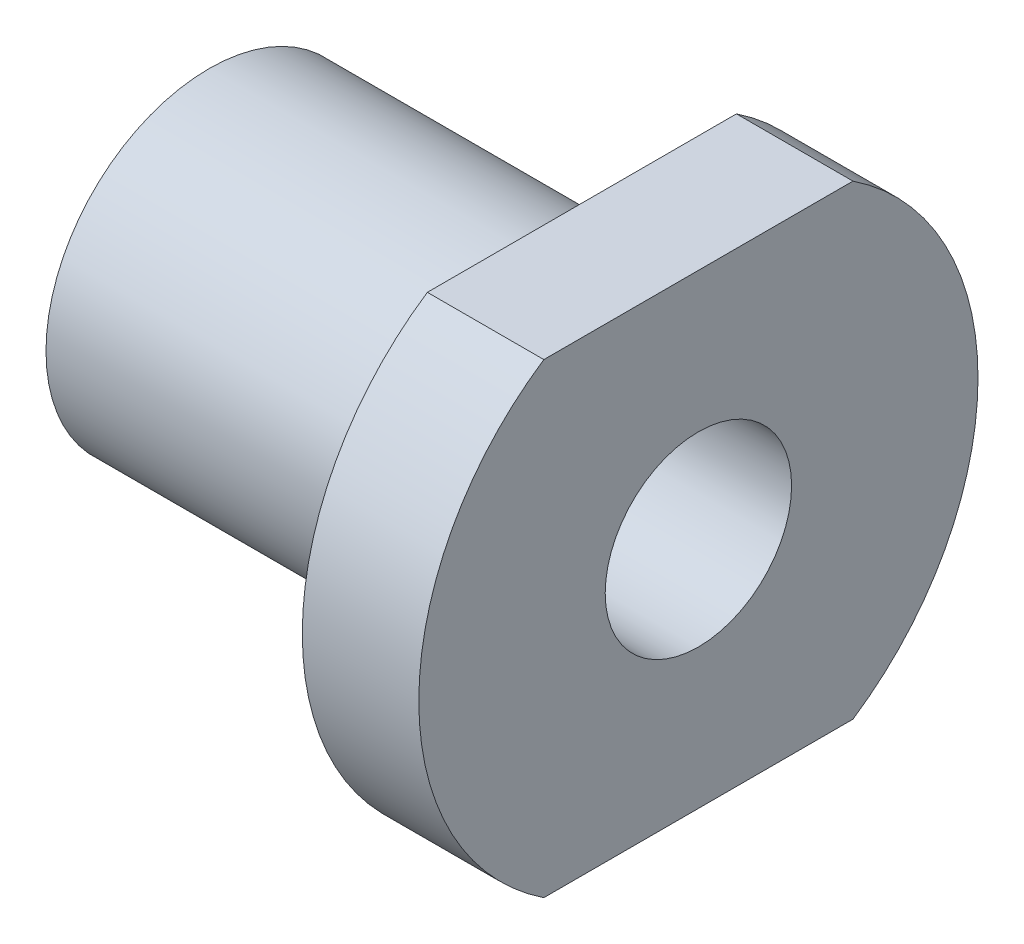
from build123d import *

# Parameters (mm, degrees)
CROQUIS2_OUTSIDE_W    = 65.964
CROQUIS2_OUTSIDE_H    = 65.964
CROQUIS2_OUTSIDE_W_2  = 60
CROQUIS2_OUTSIDE_H_2  = 40
CORTAR_EXTRUIR1_DEPTH = 10


with BuildPart() as part:
    # Croquis1 → Revolución1 (revolve)
    with BuildSketch(Plane.XY, mode=Mode.PRIVATE) as revoluci_n1_sk:
        Polygon((0, 8), (0, 24), (-10, 24), (-10, 14), (-42, 14), (-42, 8), align=None)
    revolve(revoluci_n1_sk.sketch.rotate(Axis((0, 0, 0), (-1, 0, 0)), 90), axis=Axis((0, 0, 0), (-1, 0, 0)))

    # Croquis2 outside → Cortar-Extruir1 (cut)
    with BuildSketch(Plane(origin=(0, 0, 0), x_dir=(0, 0, -1), z_dir=(1, 0, 0))):
        Rectangle(CROQUIS2_OUTSIDE_W, CROQUIS2_OUTSIDE_H)
        Rectangle(CROQUIS2_OUTSIDE_W_2, CROQUIS2_OUTSIDE_H_2, mode=Mode.SUBTRACT)
    extrude(amount=-CORTAR_EXTRUIR1_DEPTH, mode=Mode.SUBTRACT)


solid = part.part
